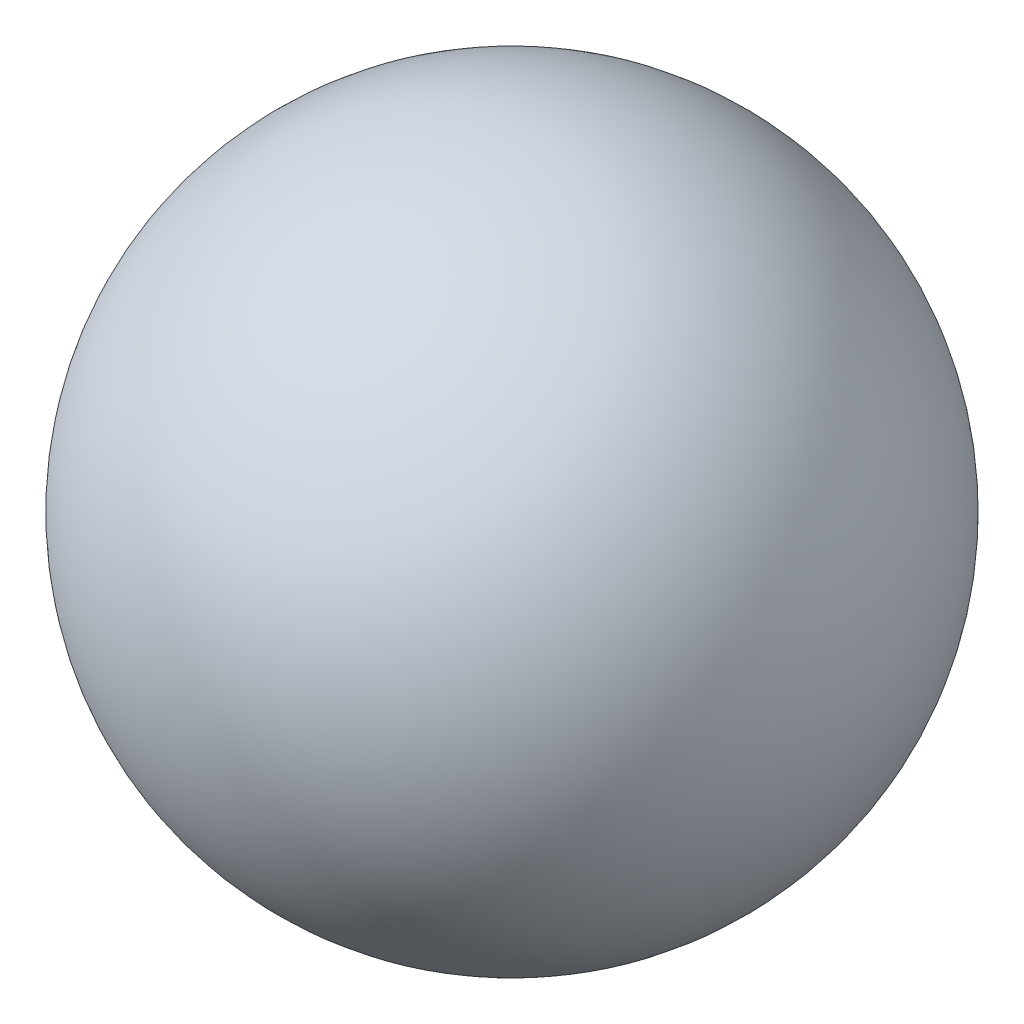
from build123d import *


with BuildPart() as part:
    # 草图1 → 旋转1 (revolve)
    with BuildSketch(Plane.XY):
        with BuildLine():
            ThreePointArc((0, 12), (12, 0), (0, -12))
            Line((0, -12), (0, 0))
            Line((0, 0), (0, 12))
        make_face()
    revolve(axis=Axis((0, -12, 0), (0, 1, 0)))


solid = part.part
